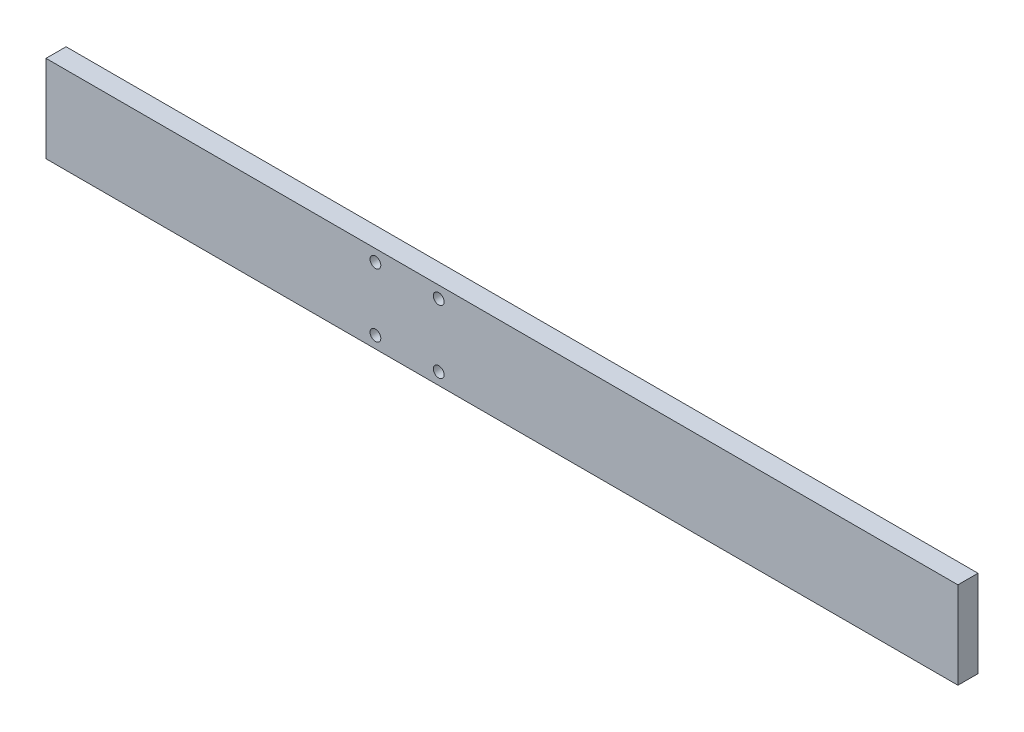
from build123d import *

# Parameters (mm, degrees)
SKETCH1_R           = 1.7
BOSS_EXTRUDE1_DEPTH = 6.35


with BuildPart() as part:
    # Sketch1 → Boss-Extrude1 (new body)
    with BuildSketch(Plane.XY):
        Polygon((242.29, 0), (288.29, 0), (288.29, 27.5), (0, 27.5), (0, 0), align=None)
        with Locations((104.145, 3.75)):
            Circle(SKETCH1_R, mode=Mode.SUBTRACT)
        with Locations((124.145, 3.75)):
            Circle(SKETCH1_R, mode=Mode.SUBTRACT)
        with Locations((124.145, 23.75)):
            Circle(SKETCH1_R, mode=Mode.SUBTRACT)
        with Locations((104.145, 23.75)):
            Circle(SKETCH1_R, mode=Mode.SUBTRACT)
    extrude(amount=BOSS_EXTRUDE1_DEPTH)


solid = part.part
